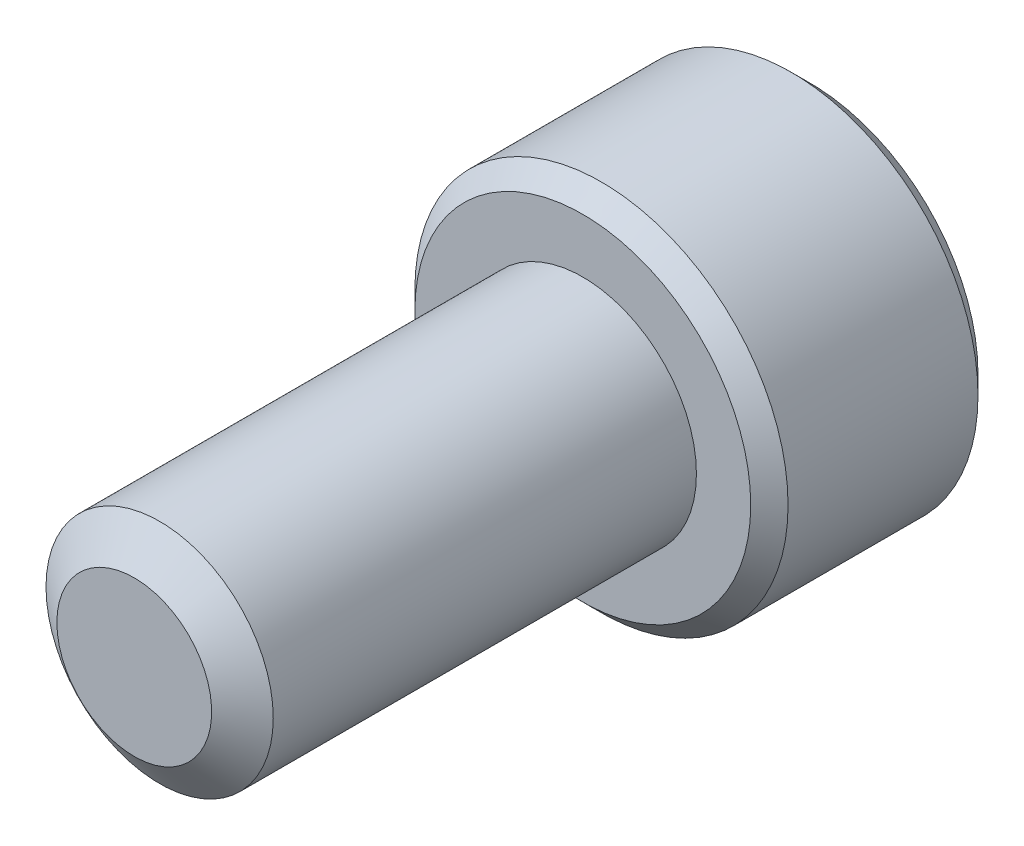
from build123d import *

# Parameters (mm, degrees)
SKETCH1_R           = 2.413
BOSS_EXTRUDE1_DEPTH = 9.525
SKETCH3_R           = 3.9624
BOSS_EXTRUDE2_DEPTH = 4.826
CUT_EXTRUDE1_START  = -4.826
CUT_EXTRUDE1_DEPTH  = 2.9765625
CHAMFER1_SIZE       = 0.39624


with BuildPart() as part:
    # Sketch1 → Boss-Extrude1 (new body)
    with BuildSketch(Plane.XY):
        with Locations(Location((0, 0, 0), (0, 0, 180))):
            Circle(SKETCH1_R)
    extrude(amount=BOSS_EXTRUDE1_DEPTH)

    # Sketch2 → Cut-Revolve1 (revolve, cut)
    with BuildSketch(Plane(origin=(0, 0, 0), x_dir=(0, 0, -1), z_dir=(1, 0, 0)), mode=Mode.PRIVATE) as cut_revolve1_sk:
        Polygon((-9.525, 2.413), (-9.525, 1.643444262), (-8.986151271, 2.413), align=None)
    revolve(cut_revolve1_sk.sketch.rotate(Axis((0, 0, 0), (0, 0, 1)), 90), axis=Axis((0, 0, 0), (0, 0, 1)), mode=Mode.SUBTRACT)

    # Sketch3 → Boss-Extrude2 (add)
    with BuildSketch(Plane.XY):
        Circle(SKETCH3_R)
    extrude(amount=-BOSS_EXTRUDE2_DEPTH)

    # Sketch4 → Cut-Extrude1 (cut)
    with BuildSketch(Plane.XY.offset(CUT_EXTRUDE1_START)):
        Polygon((0, -2.291358881), (1.984375, -1.14567944), (1.984375, 1.14567944), (0, 2.291358881), (-1.984375, 1.14567944), (-1.984375, -1.14567944), align=None)
    extrude(amount=CUT_EXTRUDE1_DEPTH, mode=Mode.SUBTRACT)

    # Cut-Extrude2 cone 1 section (through the dimple's axis) → Cut-Extrude2 (revolve, cut)
    with BuildSketch(Plane(origin=(0, 0, -4.826), x_dir=(0, 1, 0), z_dir=(1, 0, 0))):
        Polygon((0, 0), (2.291358881, 0), (0, 2.291358881), align=None)
    revolve(axis=Axis((0, 0, -4.826), (0, 0, 1)), mode=Mode.SUBTRACT)

    # Chamfer1
    chamfer1_edges = [part.edges().sort_by_distance(p)[0] for p in [
        (-3.9624, 0, -4.826),
        (-3.9624, 0, 0),
    ]]
    chamfer(chamfer1_edges, length=CHAMFER1_SIZE)


solid = part.part
